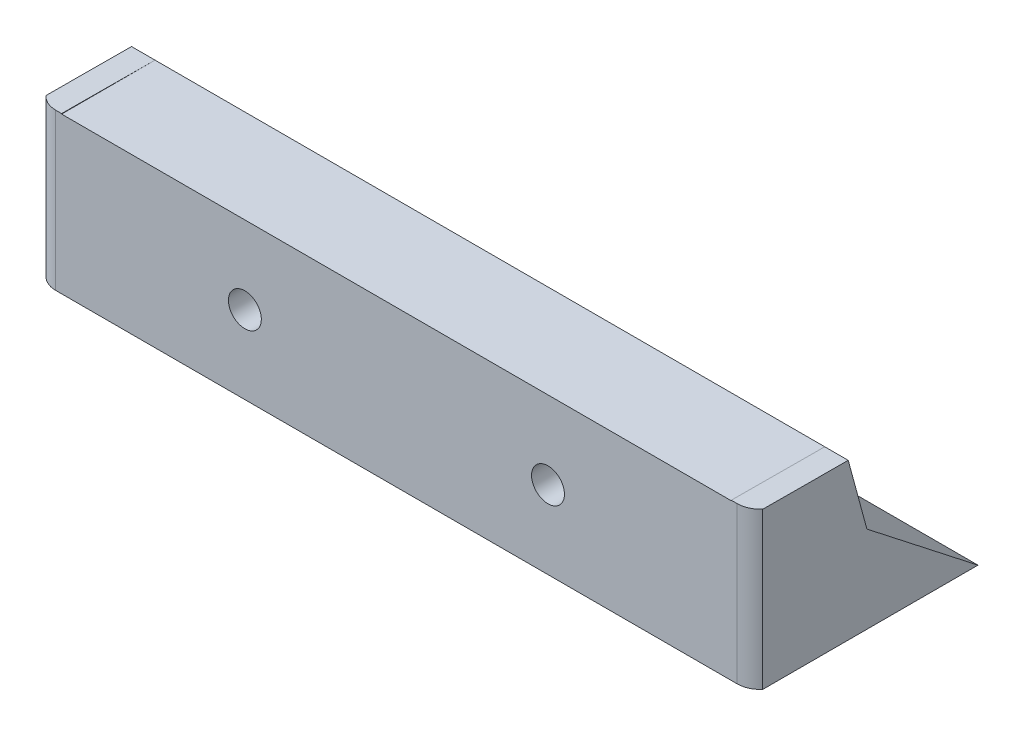
from build123d import *

# Parameters (mm, degrees)
SKETCH1_R               = 2.15
BOSS_EXTRUDE1_DEPTH     = 31
CUT_EXTRUDE1_REACH      = 45.327
SKETCH2_W               = 57
SKETCH2_H               = 12
SKETCH7_R               = 1.4
CUT_EXTRUDE2_DEPTH      = 9
CUT_EXTRUDE3_DEPTH      = 68.771693944
FILLET1_R               = 2
CUT_EXTRUDE4_DEPTH      = 39.007433483
CUT_EXTRUDE4_DEPTH_BACK = 39.007433483
SKETCH9_W               = 62
SKETCH9_H               = 45.1
SKETCH9_W_2             = 61
SKETCH9_H_2             = 43.1


with BuildPart() as part:
    # Sketch1 → Boss-Extrude1 (new, symmetric)
    with BuildSketch(Plane(origin=(0, 0, 0), x_dir=(0, 0, -1), z_dir=(1, 0, 0))):
        with BuildLine():
            Line((-4.25, 0), (-4.25, -4))
            ThreePointArc((-4.25, -4), (-4.105356672, -4.642657212), (-3.699322277, -5.161372987))
            Line((-3.699322277, -5.161372987), (-2.000677723, -6.549868444))
            ThreePointArc((-2.000677723, -6.549868444), (-1.594643328, -7.068584218), (-1.45, -7.71124143))
            Line((-1.45, -7.71124143), (-1.45, -21))
            Line((-1.45, -21), (17.55, -21))
            Line((17.55, -21), (8.093870957, -13.612062296))
            Line((8.093870957, -13.612062296), (4.101919606, 1.112095114))
            ThreePointArc((4.101919606, 1.112095114), (-0.560955289, 4.212817248), (-4.25, 0))
        make_face()
        Circle(SKETCH1_R, mode=Mode.SUBTRACT)
    extrude(amount=BOSS_EXTRUDE1_DEPTH, both=True)

    # Cut-Extrude1: up to this plane
    cut_extrude1_end = Plane(origin=(31, -13.612062296, -8.093870957), z_dir=(0, -0.26166943856052705, 0.9651575544559649))
    # Sketch2 → Cut-Extrude1 (cut, up to the surface)
    with BuildSketch(Plane.XY.offset(4.25), mode=Mode.PRIVATE) as cut_extrude1_sk1:
        with Locations((0, -1.75)):
            Rectangle(SKETCH2_W, SKETCH2_H)
    cut_extrude1_tool1 = split(extrude(cut_extrude1_sk1.sketch, amount=-CUT_EXTRUDE1_REACH, mode=Mode.PRIVATE), bisect_by=cut_extrude1_end, keep=Keep.BOTH, mode=Mode.PRIVATE)
    add(cut_extrude1_tool1.solids().sort_by_distance((0, -1.75, 4.25))[0], mode=Mode.SUBTRACT)

    # Sketch7 → Cut-Extrude2 (cut)
    with BuildSketch(Plane.XY.offset(4.25)):
        with Locations((-12.9, -14.375)):
            Circle(SKETCH7_R)
        with Locations(Location((12.9, -14.375, 0), (0, 0, 90))):
            Circle(SKETCH7_R)
    extrude(amount=-CUT_EXTRUDE2_DEPTH, mode=Mode.SUBTRACT)

    # Sketch8 → Cut-Extrude3 (cut, through all)
    with BuildSketch(Plane(origin=(31, 0, 0), x_dir=(0, 0, -1), z_dir=(1, 0, 0))):
        with BuildLine():
            Line((-1.45, -7.71124143), (6.504573393, -7.75))
            Line((6.504573393, -7.75), (4.101919606, 1.112095114))
            ThreePointArc((4.101919606, 1.112095114), (-0.560955289, 4.212817248), (-4.25, 0))
            Line((-4.25, 0), (-4.25, -4))
            ThreePointArc((-4.25, -4), (-4.105356672, -4.642657212), (-3.699322277, -5.161372987))
            Line((-3.699322277, -5.161372987), (-2.000677723, -6.549868444))
            ThreePointArc((-2.000677723, -6.549868444), (-1.594643328, -7.068584218), (-1.45, -7.71124143))
        make_face()
    extrude(amount=-CUT_EXTRUDE3_DEPTH, mode=Mode.SUBTRACT)

    # Fillet1
    fillet1_edges = [part.edges().sort_by_distance(p)[0] for p in [
        (31, -14.355620715, 1.45),
        (-31, -14.355620715, 1.45),
    ]]
    fillet(fillet1_edges, radius=FILLET1_R)

    # Sketch9 → Cut-Extrude4 (cut, two sides: drawn at the far end of the back side and taken through both)
    with BuildSketch(Plane(origin=(0, -7.75, 0), x_dir=(1, 0, 0), z_dir=(0, 1, 0)).offset(-CUT_EXTRUDE4_DEPTH_BACK)):
        Rectangle(SKETCH9_W, SKETCH9_H)
        Rectangle(SKETCH9_W_2, SKETCH9_H_2, mode=Mode.SUBTRACT)
    extrude(amount=CUT_EXTRUDE4_DEPTH + CUT_EXTRUDE4_DEPTH_BACK, mode=Mode.SUBTRACT)


solid = part.part
